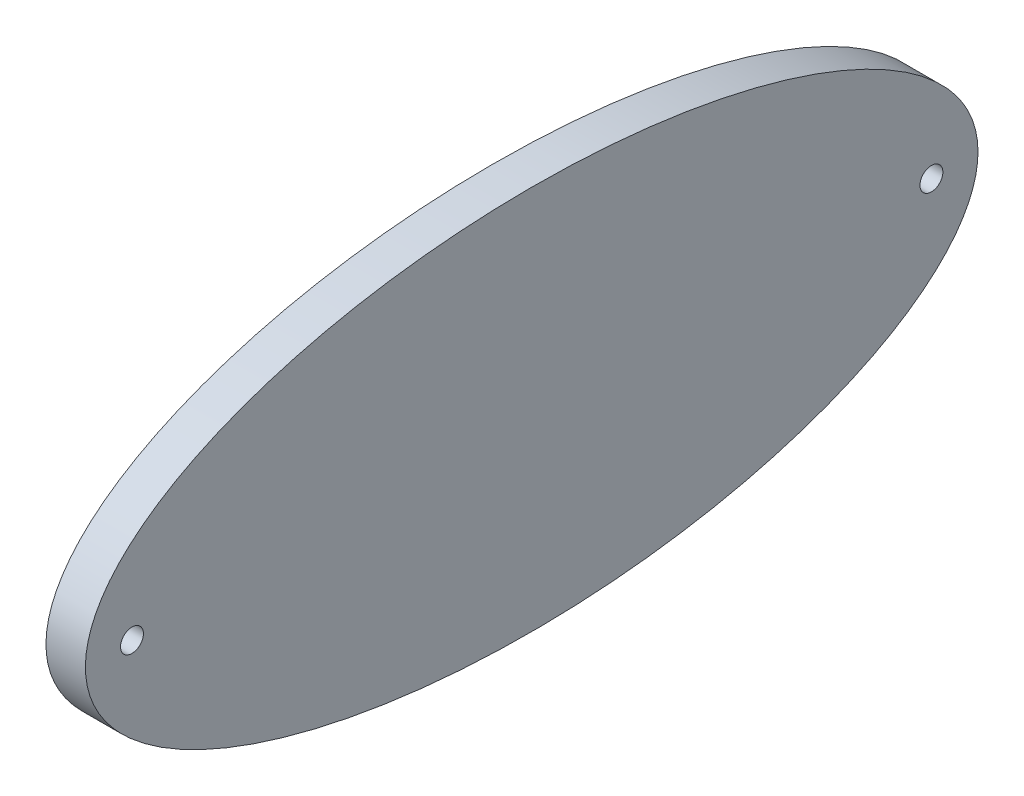
from build123d import *

# Parameters (mm, degrees)
SKETCH1_RX          = 57.5
SKETCH1_RY          = 24.8
SKETCH1_R           = 1.4732
BOSS_EXTRUDE1_DEPTH = 5.08


with BuildPart() as part:
    # Sketch1 → Boss-Extrude1 (new body)
    with BuildSketch(Plane(origin=(0, 0, 0), x_dir=(0, 0, -1), z_dir=(1, 0, 0))):
        with Locations((0, 0)):
            Ellipse(SKETCH1_RX, SKETCH1_RY)
        with Locations((-51.5, 0)):
            Circle(SKETCH1_R, mode=Mode.SUBTRACT)
        with Locations((51.5, 0)):
            Circle(SKETCH1_R, mode=Mode.SUBTRACT)
    extrude(amount=BOSS_EXTRUDE1_DEPTH)


solid = part.part
